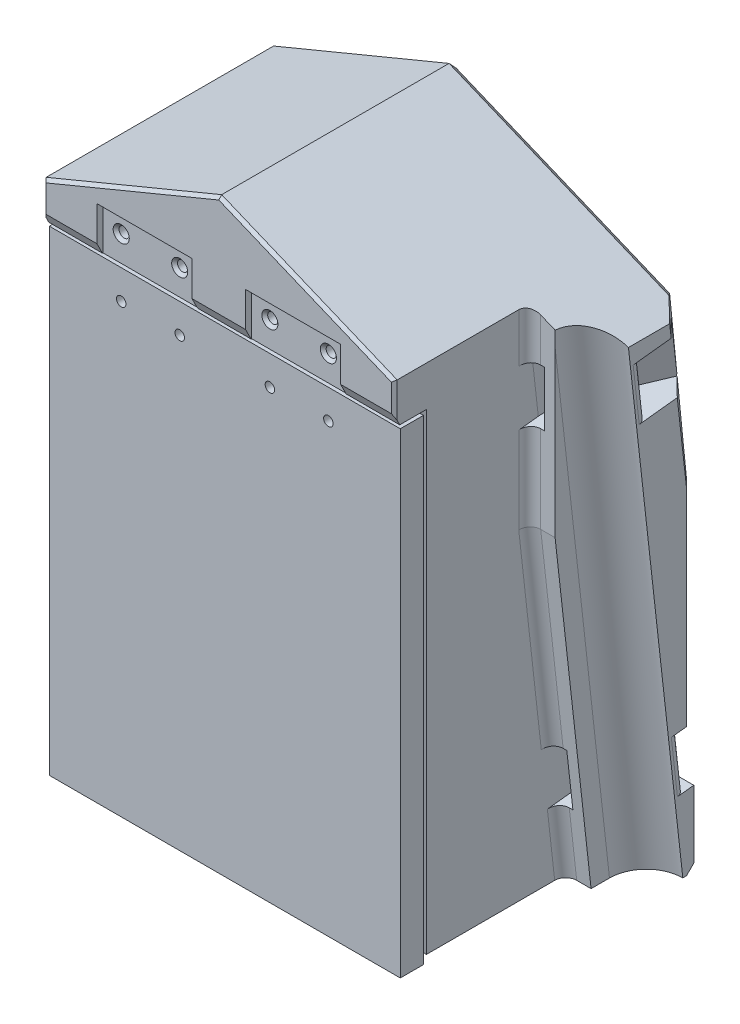
from build123d import *

# Parameters (mm, degrees)
SKETCH1_W               = 90
SKETCH1_H               = 123.117749006
MAIN_EXTRUDE_DEPTH      = 60
REAR_EXTRUDE_DEPTH      = 5
BOSS_EXTRUDE3_REACH     = 179.494
CUT_EXTRUDE9_DEPTH      = 204.523867214
CUT_EXTRUDE10_DEPTH     = 15
LPATTERN1_COUNT         = 2
LPATTERN1_PITCH         = 94
FILLET2_R               = 3
SKETCH9_R               = 3
INNER_DRAIN_HOLES_DEPTH = 15
CUT_EXTRUDE2_DEPTH      = 8
SKETCH5_W               = 26
SKETCH5_H               = 27
CUT_EXTRUDE3_DEPTH      = 1.65
SKETCH15_R              = 1.4
CUT_EXTRUDE7_DEPTH      = 40
SKETCH12_W              = 96.002
SKETCH12_H              = 130.117749006
BOSS_EXTRUDE5_DEPTH     = 6.35
SKETCH13_R              = 1.3
CUT_EXTRUDE8_DEPTH      = 131.235729892
CHAMFER4_SIZE           = 3
CHAMFER4_SIZE2          = 1.5
CHAMFER7_SIZE           = 0.8
CAVITY_FILLET_R         = 5
SKETCH21_R              = 1.3
BOSS_EXTRUDE10_DEPTH    = 3
SKETCH22_R              = 2
CUT_EXTRUDE11_DEPTH     = 129.639507308
CHAMFER6_SIZE           = 0.8
CHAMFER2_SIZE           = 2
CHAMFER9_SIZE           = 0.8
FILLET3_R               = 2


with BuildPart() as part:
    # Sketch1 → main-extrude (new body)
    with BuildSketch(Plane.XY):
        Polygon((-48, 73.558874503), (-48, -66.558874503), (48, -66.558874503), (48, 73.558874503), (0, 93.441125497), align=None)
        Rectangle(SKETCH1_W, SKETCH1_H, mode=Mode.SUBTRACT)
    extrude(amount=MAIN_EXTRUDE_DEPTH)

    # Sketch2 → rear-extrude (add)
    with BuildSketch(Plane.XY):
        Polygon((48, -66.558874503), (48, 73.558874503), (0, 93.441125497), (-48, 73.558874503), (-48, -66.558874503), align=None)
    extrude(amount=-REAR_EXTRUDE_DEPTH)

    # Boss-Extrude3: up to this plane
    boss_extrude3_end = Plane(origin=(48, 73.558874503, 60), z_dir=(-0.38268343236508395, -0.9238795325112892, 0))
    # Sketch6 → Boss-Extrude3 (add, up to the surface)
    with BuildSketch(Plane.XZ.offset(66.558874503), mode=Mode.PRIVATE) as boss_extrude3_sk1:
        Polygon((48, 22.9375), (53, 22.9375), (57, 22.9375), (64.9375, 22.9375), (64.9375, 15), (64.9375, -5), (48, -5), align=None)
    boss_extrude3_tool1 = split(extrude(boss_extrude3_sk1.sketch, amount=-BOSS_EXTRUDE3_REACH, mode=Mode.PRIVATE), bisect_by=boss_extrude3_end, keep=Keep.BOTH, mode=Mode.PRIVATE)
    add(boss_extrude3_tool1.solids().sort_by_distance((56.46875, -66.558875, 8.96875))[0])

    # Sketch20 → Cut-Extrude9 (cut, through all)
    with BuildSketch(Plane(origin=(64.9375, -67.669542231, 7.938129462), x_dir=(1, 0, 0), z_dir=(0, 0.9938129461744798, 0.11106677278106515))):
        with BuildLine():
            Line((10, 0), (10, -24.56642069))
            Line((10, -24.56642069), (-16.9375, -24.56642069))
            Line((-16.9375, -24.56642069), (-16.9375, -5))
            Line((-16.9375, -5), (-10, -5))
            Line((-10, -5), (-10, 0))
            ThreePointArc((-10, 0), (0, 10), (10, 0))
        make_face()
        Polygon((21.213203436, 0), (-21.213203436, 42.426406871), (21.213203436, 42.426406871), align=None)
    extrude(amount=CUT_EXTRUDE9_DEPTH, mode=Mode.SUBTRACT)

    # Sketch7 → Cut-Extrude10 (cut)
    with BuildSketch(Plane(origin=(64.9375, -47.793283307, 10.159464917), x_dir=(1, 0, 0), z_dir=(0, 0.9938129461744798, 0.11106677278106515))):
        with BuildLine():
            Line((-16.9375, -15), (-12.9375, -15))
            Line((-12.9375, -15), (-12.9375, -5))
            Line((-12.9375, -5), (-12.9375, 0))
            ThreePointArc((-12.9375, 0), (-9.148193982, 9.148193982), (0, 12.9375))
            Line((0, 12.9375), (49.336610553, 12.9375))
            Line((49.336610553, 12.9375), (10, 51.195508076))
            Line((10, 51.195508076), (-14.668305277, 8.46875))
            ThreePointArc((-14.668305277, 8.46875), (-16.360368683, 4.383747576), (-16.9375, 0))
            Line((-16.9375, 0), (-16.9375, -15))
        make_face()
    cut_extrude10 = extrude(amount=CUT_EXTRUDE10_DEPTH, mode=Mode.SUBTRACT)

    # LPattern1: Cut-Extrude10 ×2
    with Locations(*[Vector(0, 0.9938129461744797, 0.11106677278106512) * (i * LPATTERN1_PITCH) for i in range(1, LPATTERN1_COUNT)]):
        add(cut_extrude10, mode=Mode.SUBTRACT)

    # Fillet2
    fillet2_edges = [part.edges().sort_by_distance(p)[0] for p in [
        (48, -57.453745837, 14.110956612),
        (48, 33.444518996, 22.9375),
        (48, 67.008063987, 22.9375),
        (48, -5.95812744, 19.86601562),
    ]]
    fillet(fillet2_edges, radius=FILLET2_R)

    # Sketch9 → inner-drain-holes (cut)
    with BuildSketch(Plane.XZ.offset(66.558874503)):
        with Locations(Location((-30, 3, 0), (0, 0, 270))):
            Circle(SKETCH9_R)
        with Locations(Location((0, 3, 0), (0, 0, 270))):
            Circle(SKETCH9_R)
        with Locations(Location((30, 3, 0), (0, 0, 270))):
            Circle(SKETCH9_R)
    extrude(amount=-INNER_DRAIN_HOLES_DEPTH, mode=Mode.SUBTRACT)

    # Sketch4 → Cut-Extrude2 (cut)
    with BuildSketch(Plane.XY.offset(60)):
        Polygon((-48, 61.558874503), (-48, -66.558874503), (48, -66.558874503), (48, 61.558874503), (48, 62.558874503), (-48, 62.558874503), align=None)
    extrude(amount=-CUT_EXTRUDE2_DEPTH, mode=Mode.SUBTRACT)

    # Sketch5 → Cut-Extrude3 (cut)
    with BuildSketch(Plane.XY.offset(60)):
        with Locations((-20.333333333, 61.558874503)):
            Rectangle(SKETCH5_W, SKETCH5_H)
        with Locations((20.333333333, 61.558874503)):
            Rectangle(SKETCH5_W, SKETCH5_H)
    extrude(amount=-CUT_EXTRUDE3_DEPTH, mode=Mode.SUBTRACT)

    # Sketch15 → Cut-Extrude7 (cut)
    with BuildSketch(Plane.XY.offset(58.35)):
        with Locations((-28.333333333, 69.558874503)):
            Circle(SKETCH15_R)
        with Locations((-12.333333333, 69.558874503)):
            Circle(SKETCH15_R)
        with Locations(Location((28.333333333, 69.558874503, 0), (0, 0, 180))):
            Circle(SKETCH15_R)
        with Locations(Location((12.333333333, 69.558874503, 0), (0, 0, 180))):
            Circle(SKETCH15_R)
    extrude(amount=-CUT_EXTRUDE7_DEPTH, mode=Mode.SUBTRACT)

    # Chamfer4
    chamfer4_edges = [part.edges().sort_by_distance(p)[0] for p in [
        (40.666666667, 62.558874503, 60),
        (0, 62.558874503, 60),
        (-40.666666667, 62.558874503, 60),
    ]]
    chamfer4_side = [part.faces().sort_by_distance(p)[0] for p in [
        (0, 76.208462952, 60),
    ]]
    chamfer(chamfer4_edges, length=CHAMFER4_SIZE, length2=CHAMFER4_SIZE2, reference=chamfer4_side[0])

    # Chamfer7
    chamfer7_edges = [part.edges().sort_by_distance(p)[0] for p in [
        (-29.733333333, 69.558874503, 58.35),
        (13.733333333, 69.558874503, 58.35),
        (29.733333333, 69.558874503, 58.35),
        (-13.733333333, 69.558874503, 58.35),
    ]]
    chamfer(chamfer7_edges, length=CHAMFER7_SIZE)

    # cavity-fillet
    cavity_fillet_edges = [part.edges().sort_by_distance(p)[0] for p in [
        (-45, -61.558874503, 26),
        (45, -61.558874503, 26),
        (-45, 61.558874503, 26),
        (45, 61.558874503, 26),
    ]]
    fillet(cavity_fillet_edges, radius=CAVITY_FILLET_R)

    # Sketch22 → Cut-Extrude11 (cut, through all)
    with BuildSketch(Plane.XY):
        with Locations((-38.5, 55.058874503)):
            Circle(SKETCH22_R)
        with Locations((38.5, 55.058874503)):
            Circle(SKETCH22_R)
        with Locations((-38.5, -55.058874503)):
            Circle(SKETCH22_R)
        with Locations((38.5, -55.058874503)):
            Circle(SKETCH22_R)
    extrude(amount=-CUT_EXTRUDE11_DEPTH, mode=Mode.SUBTRACT)

    # Chamfer6
    chamfer6_edges = [part.edges().sort_by_distance(p)[0] for p in [
        (48, -2, 52),
        (0, -66.558874503, 52),
        (-48, -2, 52),
        (0, -61.558874503, 52),
        (45, 0, 52),
        (-45, 0, 52),
        (0, 61.558874503, 52),
        (43.535533906, -60.094408409, 52),
        (-43.535533906, -60.094408409, 52),
        (43.535533906, 60.094408409, 52),
        (-43.535533906, 60.094408409, 52),
    ]]
    chamfer(chamfer6_edges, length=CHAMFER6_SIZE)

    # Chamfer2
    chamfer2_edges = [part.edges().sort_by_distance(p)[0] for p in [
        (8.46875, -66.558874503, -5),
        (-48, 3.5, -5),
        (-24, 83.5, -5),
        (64.9375, -11.72456127, -5),
        (29.035058919, 81.414410308, -5),
    ]]
    chamfer(chamfer2_edges, length=CHAMFER2_SIZE)

    # Chamfer9
    chamfer9_edges = [part.edges().sort_by_distance(p)[0] for p in [
        (24, 83.5, 60),
        (48, 69.558874503, 60),
        (-24, 83.5, 60),
        (-48, 69.558874503, 60),
    ]]
    chamfer(chamfer9_edges, length=CHAMFER9_SIZE)

    # Fillet3
    fillet3_edges = [part.edges().sort_by_distance(p)[0] for p in [
        (64.9375, -38.902759838, -1.864989278),
        (64.9375, 54.515657102, 8.575287364),
    ]]
    fillet(fillet3_edges, radius=FILLET3_R)


with BuildPart() as body_2:
    # Sketch12 → Boss-Extrude5 (new body)
    with BuildSketch(Plane.XY.offset(52)):
        with Locations((0, -3.5)):
            Rectangle(SKETCH12_W, SKETCH12_H)
    extrude(amount=BOSS_EXTRUDE5_DEPTH)

    # Sketch13 → Cut-Extrude8 (cut, through all)
    with BuildSketch(Plane.XY.offset(58.35)):
        with Locations((-28.333333333, 53.558874503)):
            Circle(SKETCH13_R)
        with Locations((-12.333333333, 53.558874503)):
            Circle(SKETCH13_R)
        with Locations((12.333333333, 53.558874503)):
            Circle(SKETCH13_R)
        with Locations((28.333333333, 53.558874503)):
            Circle(SKETCH13_R)
    extrude(amount=-CUT_EXTRUDE8_DEPTH, mode=Mode.SUBTRACT)


with BuildPart() as body_3:
    # Sketch21 → Boss-Extrude10 (new body)
    with BuildSketch(Plane.XY):
        with BuildLine():
            Line((30, -61.058874503), (40, -61.058874503))
            ThreePointArc((40, -61.058874503), (43.181980515, -59.740855018), (44.5, -56.558874503))
            Line((44.5, -56.558874503), (44.5, 56.558874503))
            ThreePointArc((44.5, 56.558874503), (43.181980515, 59.740855018), (40, 61.058874503))
            Line((40, 61.058874503), (-40, 61.058874503))
            ThreePointArc((-40, 61.058874503), (-43.181980515, 59.740855018), (-44.5, 56.558874503))
            Line((-44.5, 56.558874503), (-44.5, -56.558874503))
            ThreePointArc((-44.5, -56.558874503), (-43.181980515, -59.740855018), (-40, -61.058874503))
            Line((-40, -61.058874503), (-30, -61.058874503))
            Line((-30, -61.058874503), (0, -61.058874503))
            Line((0, -61.058874503), (30, -61.058874503))
        make_face()
        with Locations((-38.5, 55.058874503)):
            Circle(SKETCH21_R, mode=Mode.SUBTRACT)
        with Locations((38.5, 55.058874503)):
            Circle(SKETCH21_R, mode=Mode.SUBTRACT)
        with Locations((-38.5, -55.058874503)):
            Circle(SKETCH21_R, mode=Mode.SUBTRACT)
        with Locations((38.5, -55.058874503)):
            Circle(SKETCH21_R, mode=Mode.SUBTRACT)
    extrude(amount=BOSS_EXTRUDE10_DEPTH)


solid = Compound([part.part, body_2.part, body_3.part])
